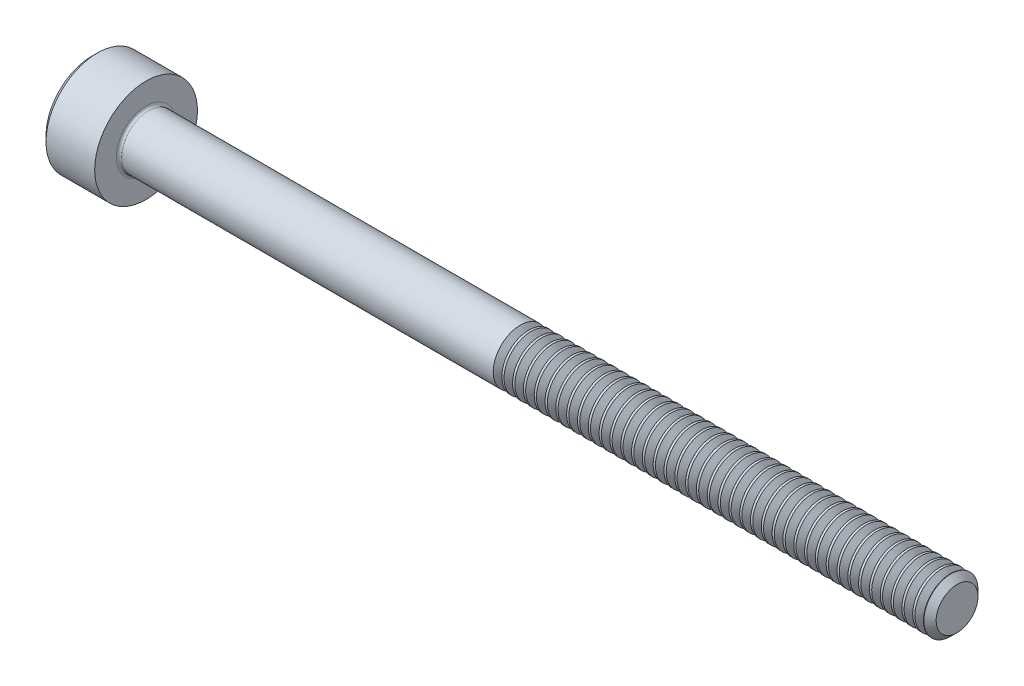
from build123d import *

# Parameters (mm, degrees)
FILLET1_R       = 0.1
HEX_2_DEPTH     = 1
THDSCHPAT_COUNT = 40
THDSCHPAT_PITCH = 0.4


with BuildPart() as part:
    # BodySke → Base-Revolve (revolve)
    with BuildSketch(Plane.XY):
        Polygon((0, 0), (0, 1.7), (0.2, 1.9), (2, 1.9), (2, 1), (31.774, 1), (32, 0.774), (32, 0), align=None)
    revolve(axis=Axis((-31.75, 0, 0), (1, 0, 0)))

    # Fillet1
    fillet1_edges = [part.edges().sort_by_distance(p)[0] for p in [
        (2, -1, 0),
    ]]
    fillet(fillet1_edges, radius=FILLET1_R)

    # Sketch2 → Hex-PreBroach (revolve, cut)
    with BuildSketch(Plane.XY):
        Polygon((0, 0.7725), (1, 0.7725), (1.446003083, 0), (0, 0), align=None)
    revolve(axis=Axis((0, 0, 0), (1, 0, 0)), mode=Mode.SUBTRACT)

    # Sketch3 → Hex 2 (cut)
    with BuildSketch(Plane(origin=(0, 0, 0), x_dir=(0, 0.500000000000001, 0.866025403784438), z_dir=(-1, 0, 0))):
        Polygon((0.446003083, 0.7725), (-0.446003083, 0.7725), (-0.892006166, 0), (-0.446003083, -0.7725), (0.446003083, -0.7725), (0.892006166, 0), align=None)
    extrude(amount=-HEX_2_DEPTH, mode=Mode.SUBTRACT)

    # ThdSchSke → ThreadSchematic (revolve, cut)
    with BuildSketch(Plane.XY):
        Polygon((16, -0.774), (15.841753096, -1), (15.841753096, -1.25), (16.158246904, -1.25), (16.158246904, -1), align=None)
    threadschematic = revolve(axis=Axis((-3.175, 0, 0), (1, 0, 0)), mode=Mode.SUBTRACT)

    # ThdSchPat: ThreadSchematic ×40
    with Locations(*[(i * THDSCHPAT_PITCH, 0, 0) for i in range(1, THDSCHPAT_COUNT)]):
        add(threadschematic, mode=Mode.SUBTRACT)


solid = part.part
